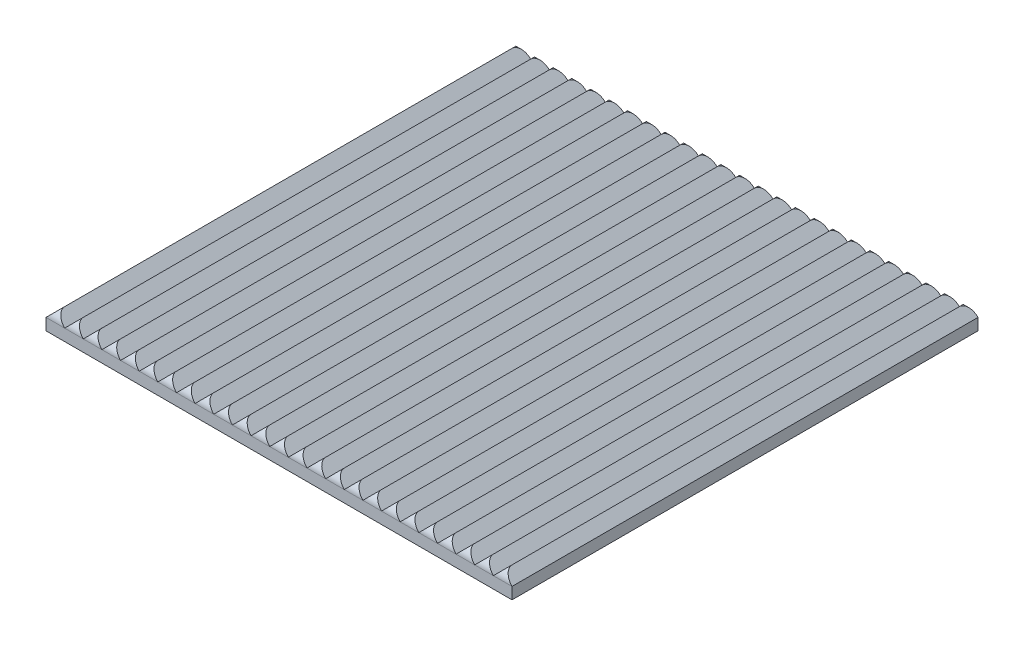
from build123d import *

# Parameters (mm, degrees)
SKETCH1_W               = 60
SKETCH1_H               = 60
SKETCH1_W_2             = 55
SKETCH1_H_2             = 55
BOSS_EXTRUDE1_DEPTH     = 40
SKETCH2_W               = 60
SKETCH2_H               = 60
BOSS_EXTRUDE2_DEPTH     = 2.5
BOSS_EXTRUDE3_DEPTH     = 60
CUT_EXTRUDE1_REACH      = 82.061
CUT_EXTRUDE2_DEPTH      = 81.060539593
CUT_EXTRUDE2_DEPTH_BACK = 81.060539593
SKETCH5_W               = 60
SKETCH5_H               = 41


with BuildPart() as part:
    # Sketch1 → Boss-Extrude1 (new body)
    with BuildSketch(Plane(origin=(0, 0, 0), x_dir=(1, 0, 0), z_dir=(0, 1, 0))):
        Rectangle(SKETCH1_W, SKETCH1_H)
        Rectangle(SKETCH1_W_2, SKETCH1_H_2, mode=Mode.SUBTRACT)
    extrude(amount=BOSS_EXTRUDE1_DEPTH)

    # Sketch2 → Boss-Extrude2 (add)
    with BuildSketch(Plane(origin=(0, 40, 0), x_dir=(1, 0, 0), z_dir=(0, 1, 0))):
        Rectangle(SKETCH2_W, SKETCH2_H)
    extrude(amount=BOSS_EXTRUDE2_DEPTH)

    # Sketch3 → Boss-Extrude3 (add)
    with BuildSketch(Plane(origin=(0, 0, -30), x_dir=(-1, 0, 0), z_dir=(0, 0, -1))):
        Polygon((-30, 42.5), (-28.8, 43.7), (-27.6, 42.5), (-26.4, 43.7), (-25.2, 42.5), (-24, 43.7), (-22.8, 42.5), (-21.6, 43.7), (-20.4, 42.5), (-19.2, 43.7), (-18, 42.5), (-16.8, 43.7), (-15.6, 42.5), (-14.4, 43.7), (-13.2, 42.5), (-12, 43.7), (-10.8, 42.5), (-9.6, 43.7), (-8.4, 42.5), (-7.2, 43.7), (-6, 42.5), (-4.8, 43.7), (-3.6, 42.5), (-2.4, 43.7), (-1.2, 42.5), (0, 43.7), (1.2, 42.5), (2.4, 43.7), (3.6, 42.5), (4.8, 43.7), (6, 42.5), (7.2, 43.7), (8.4, 42.5), (9.6, 43.7), (10.8, 42.5), (12, 43.7), (13.2, 42.5), (14.4, 43.7), (15.6, 42.5), (16.8, 43.7), (18, 42.5), (19.2, 43.7), (20.4, 42.5), (21.6, 43.7), (22.8, 42.5), (24, 43.7), (25.2, 42.5), (26.4, 43.7), (27.6, 42.5), (28.8, 43.7), (30, 42.5), (30, 42.170064374), (-30, 42.170064374), align=None)
    extrude(amount=-BOSS_EXTRUDE3_DEPTH)

    # Cut-Extrude1: up to this face of the body (flat: up to its plane)
    cut_extrude1_end = Plane(part.part.faces().sort_by_distance((30, 21.25, 0))[0])
    # Sketch4 → Cut-Extrude1 (cut, up to the picked face)
    with BuildSketch(Plane.ZY.offset(30), mode=Mode.PRIVATE) as cut_extrude1_sk1:
        with BuildLine():
            Line((-30, 42.5), (-30, 43.7))
            Line((-30, 43.7), (-28.8, 43.7))
            ThreePointArc((-28.8, 43.7), (-29.648528137, 43.348528137), (-30, 42.5))
        make_face()
    cut_extrude1_tool1 = split(extrude(cut_extrude1_sk1.sketch, amount=-CUT_EXTRUDE1_REACH, mode=Mode.PRIVATE), bisect_by=cut_extrude1_end, keep=Keep.BOTH, mode=Mode.PRIVATE)
    cut_extrude1 = cut_extrude1_tool1.solids().sort_by(Axis((-30, 43.431958, -29.731958), (1, 0, 0)))[0]
    add(cut_extrude1, mode=Mode.SUBTRACT)

    # Mirror1: Cut-Extrude1 across plane
    add(cut_extrude1.mirror(Plane.XY), mode=Mode.SUBTRACT)

    # Sketch5 → Cut-Extrude2 (cut, two sides: drawn at the far end of the back side and taken through both)
    with BuildSketch(Plane.XY.offset(30).offset(-CUT_EXTRUDE2_DEPTH_BACK)):
        with Locations((0, 20.5)):
            Rectangle(SKETCH5_W, SKETCH5_H)
    extrude(amount=CUT_EXTRUDE2_DEPTH + CUT_EXTRUDE2_DEPTH_BACK, mode=Mode.SUBTRACT)


solid = part.part
